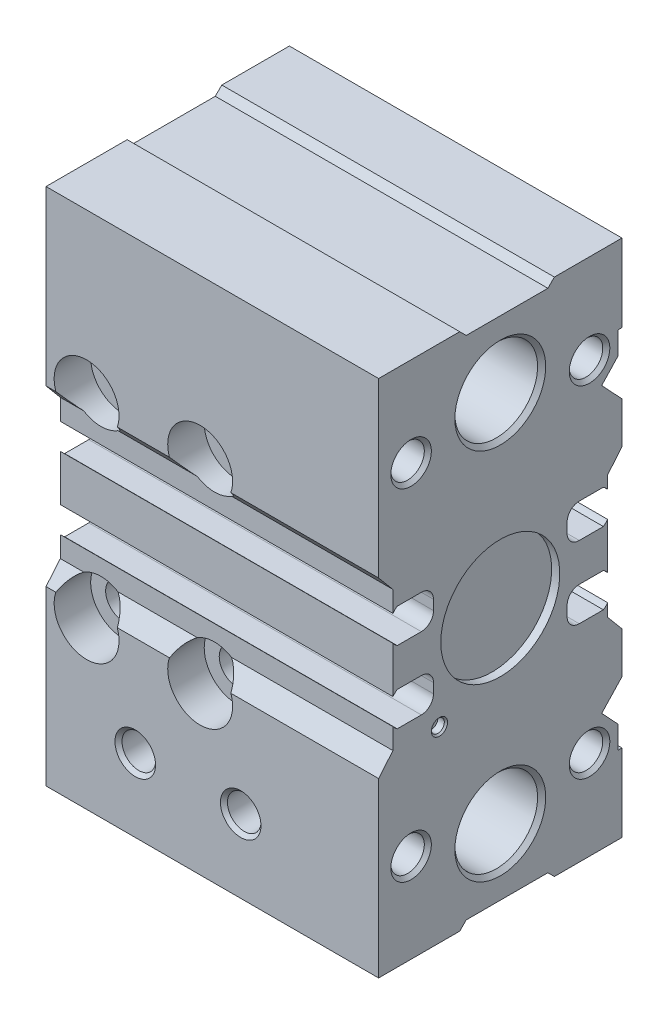
from build123d import *

# Parameters (mm, degrees)
EXTRUDE_1_DEPTH             = 41
PATTERN_LINEAR_1_COUNT      = 2
PATTERN_LINEAR_1_PITCH      = 14
PATTERN_LINEAR_1_COUNT_DIR2 = 2
PATTERN_LINEAR_1_PITCH_DIR2 = 24
PATTERN_LINEAR_2_COUNT      = 2
PATTERN_LINEAR_2_PITCH      = 17
PATTERN_LINEAR_2_COUNT_DIR2 = 2
PATTERN_LINEAR_2_PITCH_DIR2 = 54
SKETCH_10_W                 = 10
SKETCH_10_H                 = 4.1
SKETCH_11_W                 = 1
SKETCH_11_H                 = 7.333333333


with BuildPart() as part:
    # 草图1 → 凸台-拉伸1 (new body)
    with BuildSketch(Plane(origin=(0, 0, 0), x_dir=(0, 0, -1), z_dir=(1, 0, 0))):
        with BuildLine():
            Line((-15, -32), (-5, -32))
            Line((-5, -32), (-4.2, -31.2))
            Line((-4.2, -31.2), (5.866666667, -31.2))
            Line((5.866666667, -31.2), (6.666666667, -32))
            Line((6.666666667, -32), (15, -32))
            Line((15, -32), (15, -22.434782609))
            Line((15, -22.434782609), (14.5, -22.434782609))
            Line((14.5, -22.434782609), (14.5, -19.633333333))
            Line((14.5, -19.633333333), (12.5, -17.5))
            Line((12.5, -17.5), (15, -14.833333333))
            Line((15, -14.833333333), (15, -9.714205686))
            Line((15, -9.714205686), (13.235294118, -7.611111111))
            Line((13.235294118, -7.611111111), (13.235294118, -6.044444444))
            ThreePointArc((13.235294118, -6.044444444), (12.988775356, -6.313226652), (12.706722689, -6.544444444))
            Line((12.706722689, -6.544444444), (9.735294118, -6.544444444))
            ThreePointArc((9.735294118, -6.544444444), (8.674633946, -6.105104616), (8.235294118, -5.044444444))
            Line((8.235294118, -5.044444444), (8.235294118, -3.844444444))
            ThreePointArc((8.235294118, -3.844444444), (8.674633946, -2.783784273), (9.735294118, -2.344444444))
            Line((9.735294118, -2.344444444), (12.706722689, -2.344444444))
            ThreePointArc((12.706722689, -2.344444444), (12.988775356, -2.575662237), (13.235294118, -2.844444444))
            Line((13.235294118, -2.844444444), (13.235294118, 2.844444444))
            ThreePointArc((13.235294118, 2.844444444), (12.988775356, 2.575662237), (12.706722689, 2.344444444))
            Line((12.706722689, 2.344444444), (9.735294118, 2.344444444))
            ThreePointArc((9.735294118, 2.344444444), (8.674633946, 2.783784273), (8.235294118, 3.844444444))
            Line((8.235294118, 3.844444444), (8.235294118, 5.044444444))
            ThreePointArc((8.235294118, 5.044444444), (8.674633946, 6.105104616), (9.735294118, 6.544444444))
            Line((9.735294118, 6.544444444), (12.706722689, 6.544444444))
            ThreePointArc((12.706722689, 6.544444444), (12.988775356, 6.313226652), (13.235294118, 6.044444444))
            Line((13.235294118, 6.044444444), (13.235294118, 7.611111111))
            Line((13.235294118, 7.611111111), (15, 9.714205686))
            Line((15, 9.714205686), (15, 14.833333333))
            Line((15, 14.833333333), (12.5, 17.5))
            Line((12.5, 17.5), (14.5, 19.633333333))
            Line((14.5, 19.633333333), (14.5, 22.434782609))
            Line((14.5, 22.434782609), (15, 22.434782609))
            Line((15, 22.434782609), (15, 32))
            Line((15, 32), (6.666666667, 32))
            Line((6.666666667, 32), (5.866666667, 31.2))
            Line((5.866666667, 31.2), (-4.2, 31.2))
            Line((-4.2, 31.2), (-5, 32))
            Line((-5, 32), (-15, 32))
            Line((-15, 32), (-15, 10.70753902))
            Line((-15, 10.70753902), (-13.235294118, 8.604444444))
            Line((-13.235294118, 8.604444444), (-13.235294118, 6.044444444))
            ThreePointArc((-13.235294118, 6.044444444), (-12.988775356, 6.313226652), (-12.706722689, 6.544444444))
            Line((-12.706722689, 6.544444444), (-9.735294118, 6.544444444))
            ThreePointArc((-9.735294118, 6.544444444), (-8.674633946, 6.105104616), (-8.235294118, 5.044444444))
            Line((-8.235294118, 5.044444444), (-8.235294118, 3.844444444))
            ThreePointArc((-8.235294118, 3.844444444), (-8.674633946, 2.783784273), (-9.735294118, 2.344444444))
            Line((-9.735294118, 2.344444444), (-12.706722689, 2.344444444))
            ThreePointArc((-12.706722689, 2.344444444), (-12.988775356, 2.575662237), (-13.235294118, 2.844444444))
            Line((-13.235294118, 2.844444444), (-13.235294118, -2.844444444))
            ThreePointArc((-13.235294118, -2.844444444), (-12.988775356, -2.575662237), (-12.706722689, -2.344444444))
            Line((-12.706722689, -2.344444444), (-9.735294118, -2.344444444))
            ThreePointArc((-9.735294118, -2.344444444), (-8.674633946, -2.783784273), (-8.235294118, -3.844444444))
            Line((-8.235294118, -3.844444444), (-8.235294118, -5.044444444))
            ThreePointArc((-8.235294118, -5.044444444), (-8.674633946, -6.105104616), (-9.735294118, -6.544444444))
            Line((-9.735294118, -6.544444444), (-12.706722689, -6.544444444))
            ThreePointArc((-12.706722689, -6.544444444), (-12.988775356, -6.313226652), (-13.235294118, -6.044444444))
            Line((-13.235294118, -6.044444444), (-13.235294118, -8.604444444))
            Line((-13.235294118, -8.604444444), (-15, -10.70753902))
            Line((-15, -10.70753902), (-15, -32))
        make_face()
    extrude(amount=EXTRUDE_1_DEPTH)

    # 草图2 → 切除-旋转1 (revolve, cut)
    with BuildSketch(Plane.XY):
        Polygon((0, 23), (0, 28.6), (0.5, 28.1), (40.5, 28.1), (41, 28.6), (41, 23), align=None)
    revolve(axis=Axis((41, 23, 0), (-1, 0, 0)), mode=Mode.SUBTRACT)

    # 草图3 → 切除-旋转2 (revolve, cut)
    with BuildSketch(Plane.XY):
        Polygon((0, -23), (0, -17.4), (0.5, -17.9), (40.5, -17.9), (41, -17.4), (41, -23), align=None)
    revolve(axis=Axis((41, -23, 0), (-1, 0, 0)), mode=Mode.SUBTRACT)

    # 草图4 → 切除-旋转3 (revolve, cut)
    with BuildSketch(Plane(origin=(0, 12, 0), x_dir=(1, 0, 0), z_dir=(0, 1, 0))):
        Polygon((19, 15), (21.5, 15), (21.067, 14.567), (21.067, 3.583), (21.15, 3.5), (21.15, -10.5), (23, -10.5), (23, -15), (19, -15), align=None)
    cut_revolve_3 = revolve(axis=Axis((19, 12, 15), (0, 0, -1)), mode=Mode.SUBTRACT)

    # 阵列(线性)1: Cut-Revolve 3 2 × 2
    with Locations(*[(-i * PATTERN_LINEAR_1_PITCH, -j * PATTERN_LINEAR_1_PITCH_DIR2, 0) for i in range(PATTERN_LINEAR_1_COUNT) for j in range(PATTERN_LINEAR_1_COUNT_DIR2) if (i, j) != (0, 0)]):
        add(cut_revolve_3, mode=Mode.SUBTRACT)

    # 草图6 → 切除-旋转4 (revolve, cut)
    with BuildSketch(Plane(origin=(0, 27, 0), x_dir=(1, 0, 0), z_dir=(0, 1, 0))):
        Polygon((11, 15), (13.5, 15), (13.067, 14.567), (13.067, 3.693383006), (11, 2.5), align=None)
    cut_revolve_4 = revolve(axis=Axis((11, 27, -2.5), (0, 0, -1)), mode=Mode.SUBTRACT)

    # 阵列(线性)2: Cut-Revolve 4 2 × 2
    with Locations(*[(i * PATTERN_LINEAR_2_PITCH, -j * PATTERN_LINEAR_2_PITCH_DIR2, 0) for i in range(PATTERN_LINEAR_2_COUNT) for j in range(PATTERN_LINEAR_2_COUNT_DIR2) if (i, j) != (0, 0)]):
        add(cut_revolve_4, mode=Mode.SUBTRACT)

    # 草图8 → 切除-旋转5 (revolve, cut)
    with BuildSketch(Plane(origin=(0, -23, 0), x_dir=(1, 0, 0), z_dir=(0, 1, 0))):
        Polygon((11, -9.25), (13.067, -9.25), (13.067, -14.567), (13.5, -15), (11, -15), align=None)
    revolve(axis=Axis((11, -23, 15), (0, 0, -1)), mode=Mode.SUBTRACT)

    # 草图9 → 切除-旋转6 (revolve, cut)
    with BuildSketch(Plane(origin=(0, -23, 0), x_dir=(1, 0, 0), z_dir=(0, 1, 0))):
        Polygon((24, -9.25), (26.067, -9.25), (26.067, -14.567), (26.5, -15), (24, -15), align=None)
    revolve(axis=Axis((24, -23, 15), (0, 0, -1)), mode=Mode.SUBTRACT)

    # 草图10 → 切除-旋转7 (revolve, cut)
    with BuildSketch(Plane(origin=(0, 0, 0), x_dir=(1, 0, 0), z_dir=(0, 1, 0))):
        with Locations((5, 2.05)):
            Rectangle(SKETCH_10_W, SKETCH_10_H)
    revolve(axis=Axis((10, 0, 0), (-1, 0, 0)), mode=Mode.SUBTRACT)

    # 草图11 → 切除-旋转8 (revolve, cut)
    with BuildSketch(Plane(origin=(0, 0, 0), x_dir=(1, 0, 0), z_dir=(0, 1, 0))):
        with Locations((40.5, 3.666666667)):
            Rectangle(SKETCH_11_W, SKETCH_11_H)
    revolve(axis=Axis((41, 0, 0), (-1, 0, 0)), mode=Mode.SUBTRACT)

    # 草图12 → 切除-旋转9 (revolve, cut)
    with BuildSketch(Plane(origin=(11, 0, 0), x_dir=(0, 0, -1), z_dir=(1, 0, 0))):
        Polygon((-10, -26.25), (-7.933, -26.25), (-7.933, -31.567), (-7.5, -32), (-10, -32), align=None)
    revolve(axis=Axis((11, -32, 10), (0, 1, 0)), mode=Mode.SUBTRACT)

    # 草图13 → 切除-旋转10 (revolve, cut)
    with BuildSketch(Plane(origin=(24, 0, 0), x_dir=(0, 0, -1), z_dir=(1, 0, 0))):
        Polygon((-10, -26.25), (-7.933, -26.25), (-7.933, -31.567), (-7.5, -32), (-10, -32), align=None)
    revolve(axis=Axis((24, -32, 10), (0, 1, 0)), mode=Mode.SUBTRACT)

    # 草图14 → 切除-旋转11 (revolve, cut)
    with BuildSketch(Plane(origin=(0, -8.936170213, 0), x_dir=(1, 0, 0), z_dir=(0, 1, 0))):
        Polygon((40, -7.5), (40, -6.7), (40.8, -6.7), (41, -6.5), (41, -7.5), align=None)
    revolve(axis=Axis((41, -8.936170213, 7.5), (-1, 0, 0)), mode=Mode.SUBTRACT)

    # 草图15 → 切除-旋转12 (revolve, cut)
    with BuildSketch(Plane(origin=(0, 21, 0), x_dir=(1, 0, 0), z_dir=(0, 1, 0))):
        Polygon((27.8, 11), (28.993383006, 13.067), (40.567, 13.067), (41, 13.5), (41, 11), align=None)
    revolve(axis=Axis((41, 21, -11), (-1, 0, 0)), mode=Mode.SUBTRACT)

    # 草图16 → 切除-旋转13 (revolve, cut)
    with BuildSketch(Plane(origin=(0, 21, 0), x_dir=(1, 0, 0), z_dir=(0, 1, 0))):
        Polygon((27.8, -11), (28.993383006, -8.933), (40.567, -8.933), (41, -8.5), (41, -11), align=None)
    revolve(axis=Axis((41, 21, 11), (-1, 0, 0)), mode=Mode.SUBTRACT)

    # 草图17 → 切除-旋转14 (revolve, cut)
    with BuildSketch(Plane(origin=(0, -21, 0), x_dir=(1, 0, 0), z_dir=(0, 1, 0))):
        Polygon((27.8, 11), (28.993383006, 13.067), (40.567, 13.067), (41, 13.5), (41, 11), align=None)
    revolve(axis=Axis((41, -21, -11), (-1, 0, 0)), mode=Mode.SUBTRACT)

    # 草图18 → 切除-旋转15 (revolve, cut)
    with BuildSketch(Plane(origin=(0, -21, 0), x_dir=(1, 0, 0), z_dir=(0, 1, 0))):
        Polygon((27.8, -11), (28.993383006, -8.933), (40.567, -8.933), (41, -8.5), (41, -11), align=None)
    revolve(axis=Axis((41, -21, 11), (-1, 0, 0)), mode=Mode.SUBTRACT)


solid = part.part
